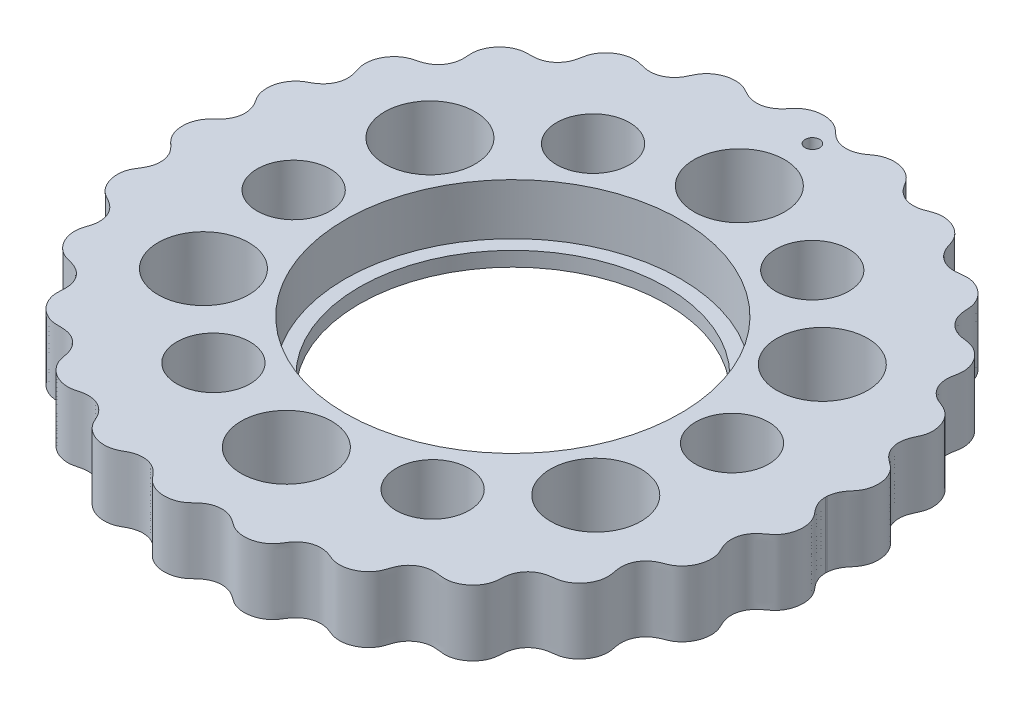
from build123d import *

# Parameters (mm, degrees)
BOSS_EXTRUDE1_DEPTH = 4.5
SKETCH2_R           = 11.475
CUT_EXTRUDE1_DEPTH  = 4.5
SKETCH3_R           = 3.1
CUT_EXTRUDE2_DEPTH  = 4.5
CIRPATTERN1_COUNT   = 6
SKETCH5_R           = 2.5
CUT_EXTRUDE3_DEPTH  = 4.5
CIRPATTERN2_COUNT   = 6
SKETCH6_R           = 0.5
CUT_EXTRUDE4_DEPTH  = 4.5
SKETCH7_R           = 11.682684044
SKETCH7_R_2         = 10.5
BOSS_EXTRUDE2_DEPTH = 1


with BuildPart() as part:
    # Sketch1 → Boss-Extrude1 (new body)
    with BuildSketch(Plane(origin=(0, 0, 0), x_dir=(1, 0, 0), z_dir=(0, 1, 0))):
        with BuildLine():
            add(Edge.make_bspline(
                [(21.4, 0), (21.4, -0.024056593), (21.40125708, -0.072797292), (21.40691199, -0.173196549), (21.421945314, -0.277745309), (21.444343725, -0.38896829), (21.474007496, -0.496769575), (21.519713196, -0.62937633), (21.596819477, -0.80192115), (21.718429718, -1.007979728), (21.897966119, -1.231918288), (22.100558232, -1.464478764), (22.283170777, -1.768982234), (22.413391042, -2.147904045), (22.461713132, -2.588752615), (22.401483161, -3.069654829), (22.246689202, -3.48571481), (22.028053447, -3.822650487), (21.770122338, -4.079849652), (21.501387326, -4.261718958), (21.221864249, -4.47651047), (20.965754362, -4.761223128), (20.767271444, -5.12137532), (20.662223859, -5.547891231), (20.669831597, -5.951738188), (20.757953256, -6.309094285), (20.890463471, -6.613993628), (21.026522729, -6.87990214), (21.136614202, -7.217211843), (21.17777615, -7.625780398), (21.118366515, -8.078184256), (20.935555274, -8.544040875), (20.676185281, -8.914331259), (20.37815472, -9.18654116), (20.097499086, -9.349166486), (19.869949477, -9.438358488), (19.642797004, -9.527181816), (19.396110322, -9.643059307), (19.111644734, -9.834945816), (18.832043332, -10.137911858), (18.62796647, -10.526669679), (18.53870404, -10.919918375), (18.537903592, -11.286445782), (18.592040298, -11.613079828), (18.656602697, -11.903472831), (18.6769681, -12.256316982), (18.613701834, -12.660266561), (18.445433186, -13.075071467), (18.162717158, -13.46839806), (17.832817974, -13.757839952), (17.526082418, -13.929543725), (17.261113567, -14.020659613), (17.055632097, -14.063095703), (16.889404969, -14.084724158), (16.681437024, -14.109043543), (16.404528364, -14.158640038), (16.069383627, -14.275269076), (15.708969864, -14.508722648), (15.404776587, -14.853825114), (15.220001393, -15.236519026), (15.145054893, -15.576552022), (15.123480362, -15.847220466), (15.111665393, -16.082776753), (15.085952864, -16.318027594), (15.004750021, -16.617655069), (14.832741666, -16.960816184), (14.572843395, -17.288179979), (14.222803418, -17.573032638), (13.844309991, -17.763286952), (13.46187357, -17.862743857), (13.137528244, -17.876861263), (12.88644673, -17.846595838), (12.636531933, -17.81285656), (12.354660141, -17.793592318), (11.999939931, -17.825993863), (11.593339756, -17.966478574), (11.21552848, -18.22859864), (10.944859624, -18.55502764), (10.79057614, -18.865524099), (10.703824048, -19.121648193), (10.633851518, -19.34598573), (10.549446754, -19.566140598), (10.395362766, -19.83426858), (10.143219722, -20.121599551), (9.80680376, -20.374816566), (9.389032603, -20.564603213), (8.969182101, -20.651511086), (8.57239876, -20.646529509), (8.21985143, -20.566980597), (7.922986458, -20.437892876), (7.584248031, -20.314166304), (7.189260098, -20.249548808), (6.756233498, -20.284899351), (6.319306191, -20.450422995), (5.976141932, -20.703781361), (5.752224288, -20.966683217), (5.606073639, -21.1928263), (5.482697339, -21.391855018), (5.345524694, -21.582593744), (5.129260459, -21.801905925), (4.813862618, -22.015317289), (4.425325735, -22.175317402), (3.973102375, -22.254019035), (3.54428038, -22.232225396), (3.159766445, -22.126788809), (2.874555191, -21.978070295), (2.677882694, -21.83413788), (2.481616479, -21.69029157), (2.244773079, -21.539611613), (1.913553813, -21.396849899), (1.480174143, -21.326885969), (1.008915064, -21.3849391), (0.613921563, -21.553552748), (0.304283336, -21.778915422), (0.063769492, -22.016683463), (-0.157841276, -22.214247034), (-0.448044558, -22.3889205), (-0.803976677, -22.51951218), (-1.223624029, -22.579845958), (-1.688804258, -22.542974687), (-2.103041989, -22.41234084), (-2.44953521, -22.212360255), (-2.719155571, -21.967429181), (-2.917030681, -21.708128299), (-3.159443039, -21.437095205), (-3.480431644, -21.193069713), (-3.895513615, -21.016224575), (-4.326614986, -20.968771559), (-4.698617845, -21.019861046), (-5.0064414, -21.123986025), (-5.247301492, -21.24079026), (-5.48210519, -21.381012328), (-5.737698692, -21.498210281), (-6.048518235, -21.581202173), (-6.409810205, -21.609851882), (-6.818074402, -21.561123686), (-7.251385598, -21.409842991), (-7.61660263, -21.180786311), (-7.902563792, -20.898519084), (-8.101534991, -20.591817032), (-8.228460601, -20.289964565), (-8.398482492, -19.966873943), (-8.651961107, -19.65137424), (-9.0130821, -19.379787839), (-9.420172408, -19.230414338), (-9.792782099, -19.19077414), (-10.115241396, -19.217196078), (-10.376185743, -19.271668806), (-10.63755606, -19.348685801), (-10.913690143, -19.396666021), (-11.234139357, -19.398105121), (-11.589613488, -19.334703747), (-11.971704676, -19.185039822), (-12.353176405, -18.929617746), (-12.649322401, -18.615401519), (-12.855663123, -18.26856562), (-12.970075822, -17.920036192), (-13.017772481, -17.594662481), (-13.132278474, -17.122566776), (-13.398695431, -16.651145724), (-13.807530545, -16.317448363), (-14.271271537, -16.148922285), (-14.589478954, -16.096608686), (-14.854453817, -16.086058751), (-15.125923555, -16.095335437), (-15.404161371, -16.071425823), (-15.713350155, -15.991857956), (-16.040018375, -15.841219255), (-16.371529953, -15.600614474), (-16.676603085, -15.257416242), (-16.884365033, -14.878054825), (-16.996865395, -14.488735497), (-17.018663233, -14.121212275), (-16.983283983, -13.793026902), (-16.979684749, -13.305329879), (-17.125033637, -12.782694254), (-17.442146056, -12.360393768), (-17.851404756, -12.085641038), (-18.14619101, -11.958380373), (-18.399510483, -11.883942253), (-18.663742909, -11.825296666), (-18.925822459, -11.731548027), (-19.203690957, -11.57677212), (-19.480635968, -11.349299896), (-19.740449774, -11.033534352), (-19.949452223, -10.624609785), (-20.055152363, -10.204361502), (-20.065600395, -9.797679008), (-19.992837924, -9.435293963), (-19.875817434, -9.125497104), (-19.783999964, -8.767534975), (-19.76149022, -8.359017231), (-19.851488197, -7.914209917), (-20.056478219, -7.532436632), (-20.306688253, -7.256767468), (-20.560406411, -7.063038174), (-20.787197148, -6.929481192), (-21.027371479, -6.807139368), (-21.256199661, -6.650124926), (-21.484912696, -6.430799323), (-21.694536313, -6.141785003), (-21.86630886, -5.771394721), (-21.96559233, -5.323066623), (-21.962343921, -4.888847464), (-21.878340879, -4.53214987), (-21.761341555, -4.270584255), (-21.63352147, -4.056497398), (-21.494941564, -3.849580149), (-21.337532051, -3.56023981), (-21.2169509, -3.167685805), (-21.197379834, -2.713744204), (-21.304948305, -2.293994242), (-21.481076224, -1.967039528), (-21.679419984, -1.718700557), (-21.865973331, -1.534662541), (-22.067141513, -1.356674207), (-22.247811602, -1.147164589), (-22.412867632, -0.878040051), (-22.542147717, -0.546597775), (-22.61725644, -0.133488281), (-22.59588731, 0.350634871), (-22.466123621, 0.791838192), (-22.267596727, 1.129802185), (-22.067696794, 1.350994912), (-21.916474048, 1.49105573), (-21.795982359, 1.603737134), (-21.652436133, 1.751974072), (-21.480912501, 1.968265229), (-21.314519838, 2.272994573), (-21.205474628, 2.682938874), (-21.210622104, 3.141176169), (-21.32617992, 3.540769781), (-21.503322976, 3.86651873), (-21.684768417, 4.131977912), (-21.814809694, 4.374716785), (-21.918287828, 4.679830092), (-21.970922506, 5.045676275), (-21.945154696, 5.472433161), (-21.80709346, 5.937259905), (-21.600122914, 6.293603685), (-21.374642068, 6.544492929), (-21.177794138, 6.703004522), (-21.036001886, 6.796486918), (-20.850507135, 6.898924844), (-20.626393818, 7.019148797), (-20.357343685, 7.206177298), (-20.081332468, 7.497464761), (-19.865676432, 7.88262472), (-19.771123487, 8.290087424), (-19.774189738, 8.652555552), (-19.83182387, 8.962210039), (-19.908402111, 9.210519203), (-19.997048361, 9.462109998), (-20.050685376, 9.731724574), (-20.062456446, 10.044970879), (-20.013529765, 10.394655256), (-19.872314727, 10.80809823), (-19.634201143, 11.184546784), (-19.343154376, 11.477701919), (-19.046991918, 11.669933439), (-18.818645961, 11.772630264), (-18.604552686, 11.837007885), (-18.413222215, 11.882652846), (-18.175963945, 11.948427492), (-17.90086558, 12.058300268), (-17.592849612, 12.25160437), (-17.294832127, 12.562007295), (-17.094131407, 12.928279478), (-16.993669397, 13.317810425), (-16.978446056, 13.64606843), (-16.996527548, 13.900391283), (-17.009914298, 14.112418548), (-17.007597186, 14.282664718), (-16.980105646, 14.534555487), (-16.889882702, 14.860504114), (-16.700561669, 15.227038526), (-16.382847463, 15.593339588), (-16.037333208, 15.844248152), (-15.701616369, 15.996482344), (-15.389642888, 16.073562612), (-15.115755738, 16.095053836), (-14.852951026, 16.086220425), (-14.600250027, 16.09643325), (-14.303568978, 16.142539069), (-13.973984224, 16.25295047), (-13.627451007, 16.465553713), (-13.333734192, 16.78485279), (-13.142948482, 17.13734534), (-13.048803253, 17.450902115), (-13.003971199, 17.700956825), (-12.963723883, 17.908813813), (-12.918446519, 18.072326684), (-12.828275639, 18.308170917), (-12.659167142, 18.599655533), (-12.384060358, 18.906245368), (-11.984436232, 19.180872702), (-11.586199089, 19.336985157), (-11.221566431, 19.399613296), (-10.899077099, 19.395031819), (-10.627925889, 19.345848062), (-10.374717103, 19.271540811), (-10.126095671, 19.21966685), (-9.825706247, 19.192400427), (-9.481881801, 19.220130446), (-9.100764084, 19.340278645), (-8.74531042, 19.571454146), (-8.507670437, 19.824116105), (-8.355534799, 20.054116726), (-8.259222569, 20.236380973), (-8.189450138, 20.385687169), (-8.102938549, 20.57255677), (-7.954083939, 20.8305437), (-7.693905847, 21.123162216), (-7.314354454, 21.382441326), (-6.860424211, 21.551996004), (-6.444100436, 21.607892875), (-6.088595916, 21.586930392), (-5.781439083, 21.512635881), (-5.526314109, 21.405005485), (-5.29474701, 21.26844266), (-5.061608014, 21.148034415), (-4.763608214, 21.036571599), (-4.397779577, 20.970836428), (-3.965488812, 20.999446345), (-3.540190469, 21.159139257), (-3.205190516, 21.395866235), (-2.95019366, 21.664828609), (-2.750993673, 21.930489218), (-2.484549796, 22.188040986), (-2.135158882, 22.398777182), (-1.723539019, 22.535904927), (-1.26628773, 22.579480695), (-0.860899206, 22.530316812), (-0.520976017, 22.419692543), (-0.241668623, 22.269462176), (-0.02170729, 22.099792533), (0.168941721, 21.908923393), (0.366524598, 21.734568012), (0.629820375, 21.553384644), (0.969883557, 21.401312816), (1.396537146, 21.32539099), (1.847079027, 21.378356692), (2.227976178, 21.526625622), (2.539367857, 21.72487764), (2.797650649, 21.9316068), (3.119821845, 22.112038669), (3.509525058, 22.227210958), (3.941690232, 22.256136806), (4.395112138, 22.183378754), (4.775754715, 22.0334681), (5.07777526, 21.839809394), (5.310750318, 21.622862488), (5.480728607, 21.402021271), (5.618069758, 21.168685553), (5.767849895, 20.950529614), (5.980365334, 20.709870263), (6.274571275, 20.480045557), (6.670672751, 20.303985885), (7.120123383, 20.247460154), (7.524097401, 20.299148427), (7.872885152, 20.415434854), (8.173541462, 20.550490013), (8.529786627, 20.642452472), (8.934279152, 20.655388115), (9.35906009, 20.574612907), (9.779532779, 20.390243921), (10.110775513, 20.148892955), (10.354927935, 19.88420713), (10.525938545, 19.614250511), (10.634343415, 19.35653205), (10.709321305, 19.095328813), (10.801865543, 18.84621759), (10.950438613, 18.559979499), (11.18132221, 18.265582324), (11.523739319, 17.999631248), (11.945915188, 17.837237408), (12.348945422, 17.789990107), (12.714047487, 17.818024669), (13.037726108, 17.87325972), (13.404298143, 17.871333967), (13.797306067, 17.782030788), (14.187344514, 17.597139362), (14.547877239, 17.313050391), (14.808161907, 16.995500147), (14.978099428, 16.676511913), (15.075444096, 16.370834419), (15.114680861, 16.093071292), (15.122165396, 15.820410725), (15.151428746, 15.555143874), (15.226625091, 15.240062746), (15.380381214, 14.89811293), (15.649114328, 14.55776787), (16.019510282, 14.299283106), (16.397798733, 14.156612545), (16.757331605, 14.095410164), (17.083250816, 14.067804314), (17.435938274, 13.972799161), (17.792083703, 13.787898406), (18.125445267, 13.508625707), (18.406613273, 13.136175484), (18.581196624, 12.750500648), (18.662608117, 12.381293854), (18.671934473, 12.043683165), (18.625340657, 11.751182618), (18.553018555, 11.421822718), (18.526834481, 11.040918335), (18.593334316, 10.617390795), (18.793816561, 10.187032971), (19.083220044, 9.856483912), (19.414752074, 9.627490729), (19.74721655, 9.481415946), (20.054617099, 9.373229786), (20.370205969, 9.192126846), (20.666845294, 8.924358576), (20.918635819, 8.570697307), (21.097121092, 8.139544084), (21.169080729, 7.721507576), (21.154402084, 7.342249842), (21.077380869, 7.012045528), (20.957391538, 6.740163122), (20.805659027, 6.437547797), (20.68754625, 6.072698876), (20.650247231, 5.644696489), (20.741861132, 5.178570007), (20.943238746, 4.78895604), (21.208670681, 4.487766534), (21.494491104, 4.266229919), (21.763781662, 4.084854635), (22.021739734, 3.830309301), (22.240237925, 3.497593232), (22.39301217, 3.096385501), (22.45756737, 2.642043936), (22.425065275, 2.222826295), (22.319026048, 1.856687557), (22.176707006, 1.583136287), (22.037252044, 1.393780171), (21.91109702, 1.244664915), (21.811945326, 1.123750225), (21.708566924, 0.98383379), (21.622612519, 0.845131874), (21.553998505, 0.708939848), (21.501235212, 0.577848336), (21.46592229, 0.469942992), (21.441355377, 0.374331782), (21.424970954, 0.292223102), (21.414290635, 0.219927472), (21.407518232, 0.159260172), (21.404038716, 0.117106787), (21.402526089, 0.092443044), (21.401939754, 0.080310922)],
                knots=[0.070289989, 0.070289989, 0.070289989, 0.070289989, 0.070289989, 0.070911185, 0.071532382, 0.072153579, 0.072774775, 0.073395972, 0.074017168, 0.075259561, 0.07696753, 0.078675499, 0.080383467, 0.082091436, 0.084794744, 0.087498052, 0.090124883, 0.092751714, 0.094549165, 0.096346615, 0.098144066, 0.099941516, 0.102357571, 0.104773625, 0.107171899, 0.109570172, 0.111225632, 0.112881091, 0.11453655, 0.11619201, 0.119052824, 0.121913638, 0.124550545, 0.127187452, 0.128992402, 0.130797352, 0.131699827, 0.132602302, 0.134407252, 0.136832113, 0.139256974, 0.141646265, 0.144035556, 0.145684239, 0.147332923, 0.148981606, 0.15063029, 0.153479755, 0.156329219, 0.158805086, 0.161280952, 0.163139881, 0.164069346, 0.16499881, 0.165928275, 0.166857739, 0.168716669, 0.171228588, 0.173740507, 0.176268341, 0.178796174, 0.180541641, 0.181414375, 0.182287109, 0.184032576, 0.185778044, 0.188261616, 0.190745188, 0.193230401, 0.195715614, 0.197582288, 0.199448961, 0.200382298, 0.201315635, 0.203182308, 0.205703189, 0.208224071, 0.210741132, 0.213258193, 0.214997172, 0.215866661, 0.216736151, 0.21847513, 0.220214109, 0.222687627, 0.225161145, 0.227739659, 0.230318173, 0.232111255, 0.233904337, 0.235697418, 0.2374905, 0.240099125, 0.24270775, 0.245213932, 0.247720113, 0.249452692, 0.250318982, 0.251185271, 0.25291785, 0.254650429, 0.257113891, 0.259577352, 0.262166073, 0.264754795, 0.266555011, 0.268355227, 0.269255335, 0.270155443, 0.27195566, 0.274573459, 0.277191259, 0.279768583, 0.282345907, 0.283988426, 0.285630945, 0.287273464, 0.288915982, 0.291454924, 0.293993866, 0.296592737, 0.299191608, 0.300998943, 0.302806277, 0.304613611, 0.306420945, 0.309047909, 0.311674873, 0.314492145, 0.315900781, 0.317309416, 0.318862905, 0.320416393, 0.321969881, 0.323523369, 0.325966731, 0.328410094, 0.331019052, 0.333628009, 0.335442437, 0.337256865, 0.339071293, 0.34088572, 0.343521843, 0.346157966, 0.348962466, 0.350364716, 0.351766966, 0.353315064, 0.354863162, 0.35641126, 0.357959358, 0.360392844, 0.36282633, 0.365445306, 0.368064282, 0.369885771, 0.371707261, 0.37352875, 0.375350239, 0.380640802, 0.383432381, 0.38482817, 0.386223959, 0.387766638, 0.389309317, 0.390851996, 0.392394675, 0.394818624, 0.397242573, 0.399871494, 0.402500415, 0.404328926, 0.406157437, 0.407985948, 0.409814459, 0.415123345, 0.417901857, 0.419291114, 0.42068037, 0.422217766, 0.423755162, 0.425292559, 0.426829955, 0.429244387, 0.431658819, 0.434297607, 0.436936394, 0.438771881, 0.440607368, 0.442442854, 0.444278341, 0.446941951, 0.449605562, 0.452370869, 0.453753523, 0.455136177, 0.456668428, 0.45820068, 0.459732932, 0.461265184, 0.463670125, 0.466075066, 0.468723637, 0.471372208, 0.473214618, 0.474135823, 0.475057027, 0.476899437, 0.478741847, 0.481414633, 0.48408742, 0.486839389, 0.488215373, 0.489591357, 0.491118606, 0.492645854, 0.494173102, 0.49570035, 0.498095831, 0.500491312, 0.503422157, 0.506353003, 0.508182885, 0.509097826, 0.510012767, 0.510927708, 0.511842649, 0.513672532, 0.516120493, 0.518568455, 0.52114213, 0.523715805, 0.525237059, 0.526758313, 0.528279567, 0.529800821, 0.532353844, 0.534906866, 0.537684502, 0.540462137, 0.541402408, 0.542342678, 0.543282949, 0.544223219, 0.54610376, 0.547984301, 0.550516682, 0.553049063, 0.555774599, 0.557137367, 0.558500134, 0.560017494, 0.561534853, 0.563052212, 0.564569572, 0.566946245, 0.569322917, 0.572675218, 0.574351368, 0.576027518, 0.577119137, 0.578210755, 0.579302374, 0.580393992, 0.582577229, 0.584760466, 0.587299503, 0.58983854, 0.591723927, 0.593609313, 0.594552007, 0.5954947, 0.596437393, 0.597380086, 0.6001648, 0.602949514, 0.605495326, 0.608041138, 0.609558812, 0.611076486, 0.612594159, 0.614111833, 0.615394062, 0.616676291, 0.61924075, 0.621770613, 0.624300476, 0.626179202, 0.628057929, 0.628997292, 0.629936656, 0.630876019, 0.631815382, 0.634590349, 0.637365315, 0.639921047, 0.64247678, 0.643999395, 0.645522011, 0.647044627, 0.648567242, 0.649855801, 0.651144359, 0.653721475, 0.656167009, 0.658612543, 0.66044063, 0.661354674, 0.662268718, 0.663182761, 0.664096805, 0.665924892, 0.668852881, 0.671780871, 0.674178928, 0.676576986, 0.678105585, 0.679634184, 0.681162783, 0.682691382, 0.684069191, 0.685447001, 0.68820262, 0.690872904, 0.693543187, 0.695383714, 0.697224241, 0.699064768, 0.700905295, 0.703551206, 0.706197117, 0.708604644, 0.711012171, 0.712545812, 0.714079453, 0.715613094, 0.717146735, 0.718531196, 0.719915657, 0.72268458, 0.725345689, 0.728006799, 0.729840388, 0.731673977, 0.733507566, 0.735341155, 0.73797726, 0.740613364, 0.74303039, 0.745447415, 0.746986238, 0.748525062, 0.750063885, 0.751602708, 0.752993754, 0.754384799, 0.757166889, 0.759818833, 0.762470776, 0.764297377, 0.766123977, 0.767950577, 0.769777177, 0.772403394, 0.77502961, 0.777456158, 0.779882706, 0.78142685, 0.782970993, 0.784515137, 0.786059281, 0.787456839, 0.788854398, 0.791649515, 0.794292299, 0.796935082, 0.798754649, 0.800574216, 0.802393783, 0.80421335, 0.806829601, 0.809445851, 0.811881941, 0.814318031, 0.81586763, 0.81741723, 0.818966829, 0.820516428, 0.821920427, 0.823324427, 0.826132425, 0.82876605, 0.831399675, 0.833212171, 0.835024667, 0.836837163, 0.838649659, 0.841255872, 0.843862085, 0.846393456, 0.848924827, 0.8505631, 0.852201372, 0.853839645, 0.855477918, 0.858046895, 0.860615872, 0.863240337, 0.865864802, 0.867670197, 0.869475592, 0.871280987, 0.873086382, 0.875682491, 0.8782786, 0.880820382, 0.883362164, 0.88500629, 0.886650415, 0.888294541, 0.889938666, 0.892519105, 0.895099544, 0.897714843, 0.900330141, 0.902128413, 0.903926685, 0.905724956, 0.907523228, 0.910109171, 0.912695114, 0.915161318, 0.917627522, 0.919361838, 0.921096153, 0.921963311, 0.922830468, 0.923697626, 0.924564784, 0.925819363, 0.926446653, 0.927073943, 0.927701233, 0.928328523, 0.928642168, 0.928955813, 0.929269458, 0.929583103, 0.929583103, 0.929583103, 0.929583103, 0.929583103], degree=4))
            Line((21.401939754, 0.080310922), (21.4, 0))
        make_face()
    extrude(amount=BOSS_EXTRUDE1_DEPTH)

    # Sketch2 → Cut-Extrude1 (cut)
    with BuildSketch(Plane(origin=(0, 4.5, 0), x_dir=(1, 0, 0), z_dir=(0, 1, 0))):
        with Locations(Location((0, 0, 0), (0, 0, 270))):
            Circle(SKETCH2_R)
    extrude(amount=-CUT_EXTRUDE1_DEPTH, mode=Mode.SUBTRACT)

    # Sketch3 → Cut-Extrude2 (cut)
    with BuildSketch(Plane(origin=(0, 4.5, 0), x_dir=(1, 0, 0), z_dir=(0, 1, 0))):
        with Locations(Location((0, 15.5, 0), (0, 0, 270))):
            Circle(SKETCH3_R)
    cut_extrude2 = extrude(amount=-CUT_EXTRUDE2_DEPTH, mode=Mode.SUBTRACT)

    # CirPattern1: Cut-Extrude2 ×6 about axis
    cirpattern1_axis = Axis((0, 0, 0), (0, 1, 0))
    for i in range(1, CIRPATTERN1_COUNT):
        add(cut_extrude2.rotate(cirpattern1_axis, i * 360 / CIRPATTERN1_COUNT), mode=Mode.SUBTRACT)

    # Sketch5 → Cut-Extrude3 (cut)
    with BuildSketch(Plane(origin=(0, 4.5, 0), x_dir=(1, 0, 0), z_dir=(0, 1, 0))):
        with Locations(Location((7.5, 12.990381057, 0), (0, 0, 270))):
            Circle(SKETCH5_R)
    cut_extrude3 = extrude(amount=-CUT_EXTRUDE3_DEPTH, mode=Mode.SUBTRACT)

    # CirPattern2: Cut-Extrude3 ×6 about axis
    cirpattern2_axis = Axis((0, 0, 0), (0, 1, 0))
    for i in range(1, CIRPATTERN2_COUNT):
        add(cut_extrude3.rotate(cirpattern2_axis, i * 360 / CIRPATTERN2_COUNT), mode=Mode.SUBTRACT)

    # Sketch6 → Cut-Extrude4 (cut)
    with BuildSketch(Plane(origin=(0, 4.5, 0), x_dir=(1, 0, 0), z_dir=(0, 1, 0))):
        with Locations(Location((0, 20.5, 0), (0, 0, 270))):
            Circle(SKETCH6_R)
    extrude(amount=-CUT_EXTRUDE4_DEPTH, mode=Mode.SUBTRACT)

    # Sketch7 → Boss-Extrude2 (add)
    with BuildSketch(Plane.XZ):
        Circle(SKETCH7_R)
        with Locations(Location((0, 0, 0), (0, 0, 270))):
            Circle(SKETCH7_R_2, mode=Mode.SUBTRACT)
    extrude(amount=-BOSS_EXTRUDE2_DEPTH)


solid = part.part
